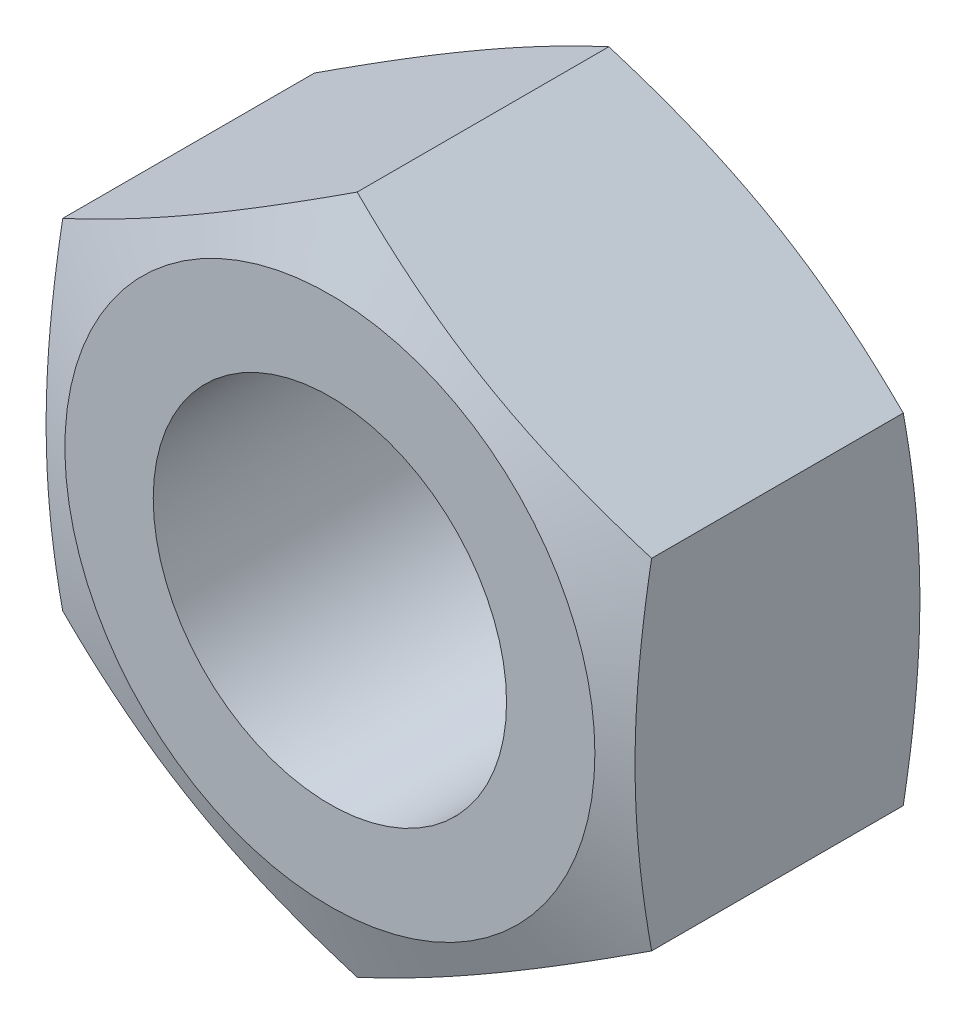
from build123d import *

# Parameters (mm, degrees)
EXTRUDE_1_DEPTH     = 5.2
SKETCH_5_R          = 3
CUT_EXTRUDE_1_DEPTH = 10.239769117


with BuildPart() as part:
    # 草图1 → 凸台-拉伸1 (new body)
    with BuildSketch(Plane.XY):
        Polygon((0, 5.773502692), (-5, 2.886751346), (-5, -2.886751346), (0, -5.773502692), (5, -2.886751346), (5, 2.886751346), align=None)
    extrude(amount=EXTRUDE_1_DEPTH)

    # 草图4 → 切除-旋转1 (revolve, cut)
    with BuildSketch(Plane(origin=(0, 0, 0), x_dir=(0, 0, -1), z_dir=(1, 0, 0))):
        Polygon((-5.2, -4.5), (-4.736482927, -5.773502692), (-5.2, -5.773502692), align=None)
    cut_revolve_1 = revolve(axis=Axis((0, 0, 5.2), (0, 0, -1)), mode=Mode.SUBTRACT)

    # 镜向1: 切除-旋转1 across plane
    add(cut_revolve_1.mirror(Plane.XY.offset(2.6)), mode=Mode.SUBTRACT)

    # 草图5 → 切除-拉伸1 (cut, through all)
    with BuildSketch(Plane.XY.offset(5.2)):
        Circle(SKETCH_5_R)
    extrude(amount=-CUT_EXTRUDE_1_DEPTH, mode=Mode.SUBTRACT)


solid = part.part
